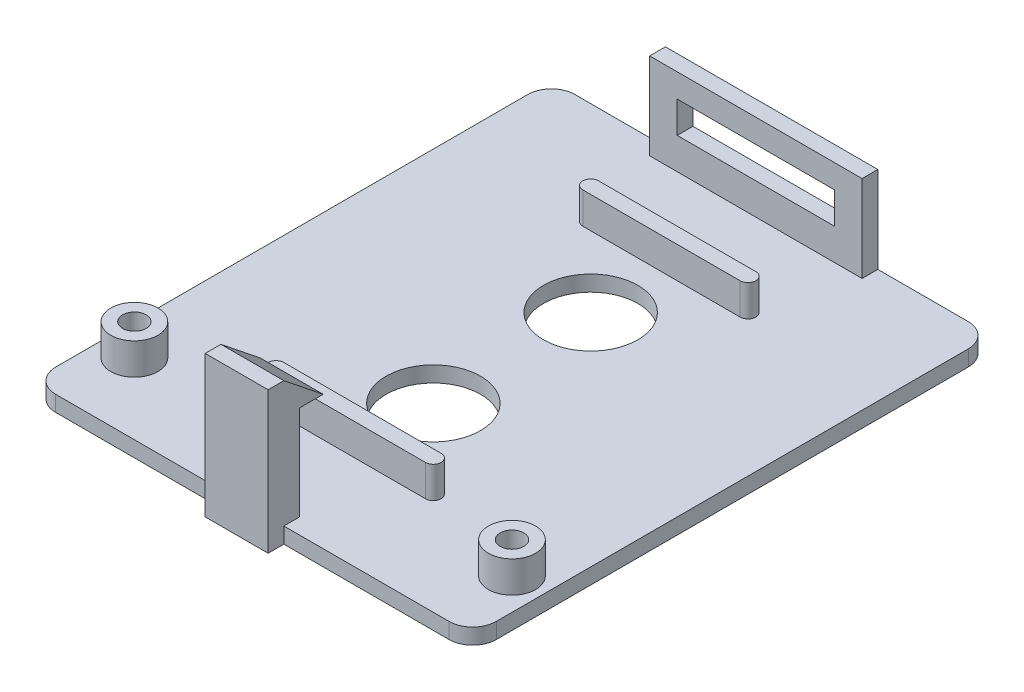
from build123d import *

# Parameters (mm, degrees)
BASE_4_R              = 1.5
BASE_4_R_2            = 0.75
BOSS_EXTRUDE5_DEPTH   = 3
BOSS_EXTRUDE5_2_DEPTH = 3
BASE_W                = 13.5
BASE_H                = 1
BOSS_EXTRUDE7_DEPTH   = 6.5
BASE_7_R              = 1.5
BASE_7_R_2            = 3
BOSS_EXTRUDE8_DEPTH   = 1
BOSS_EXTRUDE9_DEPTH   = 3
SLIT_W                = 10
SLIT_H                = 2
CUT_EXTRUDE2_DEPTH    = 6.5
BASE_13_W             = 4
BASE_13_H             = 1
BOSS_EXTRUDE12_DEPTH  = 9
BOSS_EXTRUDE13_DEPTH  = 4
CUT_EXTRUDE3_DEPTH    = 4
BASE_14_W             = 4
BASE_14_H             = 1
BOSS_EXTRUDE14_DEPTH  = 9


with BuildPart() as part:
    # Base<4> → Boss-Extrude5 (new body)
    with BuildSketch(Plane(origin=(0, 0, 0), x_dir=(1, 0, 0), z_dir=(0, 1, 0))):
        with Locations((-12, -12)):
            Circle(BASE_4_R)
        with Locations((-12, -12)):
            Circle(BASE_4_R_2, mode=Mode.SUBTRACT)
    extrude(amount=BOSS_EXTRUDE5_DEPTH)



with BuildPart() as body_2:
    # Base<4> → Boss-Extrude5 2 (new body)
    with BuildSketch(Plane(origin=(0, 0, 0), x_dir=(1, 0, 0), z_dir=(0, 1, 0))):
        with Locations((12, -12)):
            Circle(BASE_4_R)
        with Locations((12, -12)):
            Circle(BASE_4_R_2, mode=Mode.SUBTRACT)
    extrude(amount=BOSS_EXTRUDE5_2_DEPTH)


with BuildPart() as body_3:
    # Base → Boss-Extrude7 (new body)
    with BuildSketch(Plane(origin=(0, 0, 0), x_dir=(1, 0, 0), z_dir=(0, 1, 0))):
        with Locations((0, 16)):
            Rectangle(BASE_W, BASE_H)
    extrude(amount=BOSS_EXTRUDE7_DEPTH)


with BuildPart() as part_1:
    add(part.part)

    add(body_2.part)  # Boss-Extrude8 merges body 2

    add(body_3.part)  # Boss-Extrude8 merges body 3
    # Base<7> → Boss-Extrude8 (add)
    with BuildSketch(Plane(origin=(0, 0, 0), x_dir=(1, 0, 0), z_dir=(0, 1, 0))):
        with BuildLine():
            ThreePointArc((14, 15), (13.560660172, 16.060660172), (12.5, 16.5))
            Line((12.5, 16.5), (6.75, 16.5))
            Line((6.75, 16.5), (6.75, 15.5))
            Line((6.75, 15.5), (-6.75, 15.5))
            Line((-6.75, 15.5), (-6.75, 16.5))
            Line((-6.75, 16.5), (-12.5, 16.5))
            ThreePointArc((-12.5, 16.5), (-13.560660172, 16.060660172), (-14, 15))
            Line((-14, 15), (-14, -15))
            ThreePointArc((-14, -15), (-13.560660172, -16.060660172), (-12.5, -16.5))
            Line((-12.5, -16.5), (-2, -16.5))
            Line((-2, -16.5), (-2, -15.5))
            Line((-2, -15.5), (2, -15.5))
            Line((2, -15.5), (2, -16.5))
            Line((2, -16.5), (12.5, -16.5))
            ThreePointArc((12.5, -16.5), (13.560660172, -16.060660172), (14, -15))
            Line((14, -15), (14, 15))
        make_face()
        with Locations((-12, -12)):
            Circle(BASE_7_R, mode=Mode.SUBTRACT)
        with Locations((0, -5)):
            Circle(BASE_7_R_2, mode=Mode.SUBTRACT)
        with Locations((12, -12)):
            Circle(BASE_7_R, mode=Mode.SUBTRACT)
        with Locations((0, 5)):
            Circle(BASE_7_R_2, mode=Mode.SUBTRACT)
    extrude(amount=BOSS_EXTRUDE8_DEPTH)

    # Base<8> → Boss-Extrude9 (add)
    with BuildSketch(Plane(origin=(0, 0, 0), x_dir=(1, 0, 0), z_dir=(0, 1, 0))):
        with BuildLine():
            Line((-5, -9.5), (5, -9.5))
            ThreePointArc((5, -9.5), (5.5, -10), (5, -10.5))
            Line((5, -10.5), (-5, -10.5))
            ThreePointArc((-5, -10.5), (-5.5, -10), (-5, -9.5))
        make_face()
        with BuildLine():
            Line((-5, 10.5), (5, 10.5))
            ThreePointArc((5, 10.5), (5.5, 10), (5, 9.5))
            Line((5, 9.5), (-5, 9.5))
            ThreePointArc((-5, 9.5), (-5.5, 10), (-5, 10.5))
        make_face()
    extrude(amount=BOSS_EXTRUDE9_DEPTH)

    # slit → Cut-Extrude2 (cut)
    with BuildSketch(Plane.XY.offset(-15.5)):
        with Locations((0, 4)):
            Rectangle(SLIT_W, SLIT_H)
    extrude(amount=-CUT_EXTRUDE2_DEPTH, mode=Mode.SUBTRACT)

    # Base<13> → Boss-Extrude12 (add)
    with BuildSketch(Plane(origin=(0, 0, 0), x_dir=(1, 0, 0), z_dir=(0, 1, 0))):
        with Locations((0, -16)):
            Rectangle(BASE_13_W, BASE_13_H)
    extrude(amount=BOSS_EXTRUDE12_DEPTH)

    # Sketch3 → Boss-Extrude13 (add)
    with BuildSketch(Plane(origin=(2, 0, 0), x_dir=(0, 0, -1), z_dir=(1, 0, 0))):
        Polygon((-15.5, 7), (-14, 7), (-15.5, 9), align=None)
    extrude(amount=-BOSS_EXTRUDE13_DEPTH)

    # Sketch4 → Cut-Extrude3 (cut)
    with BuildSketch(Plane(origin=(2, 0, 0), x_dir=(0, 0, -1), z_dir=(1, 0, 0))):
        Polygon((-14, 7), (-16.5, 9), (-13.837162957, 9), align=None)
    extrude(amount=-CUT_EXTRUDE3_DEPTH, mode=Mode.SUBTRACT)

    # Base<14> → Boss-Extrude14 (add)
    with BuildSketch(Plane(origin=(0, 0, 0), x_dir=(1, 0, 0), z_dir=(0, 1, 0))):
        with Locations((0, -17)):
            Rectangle(BASE_14_W, BASE_14_H)
    extrude(amount=BOSS_EXTRUDE14_DEPTH)


solid = part_1.part
